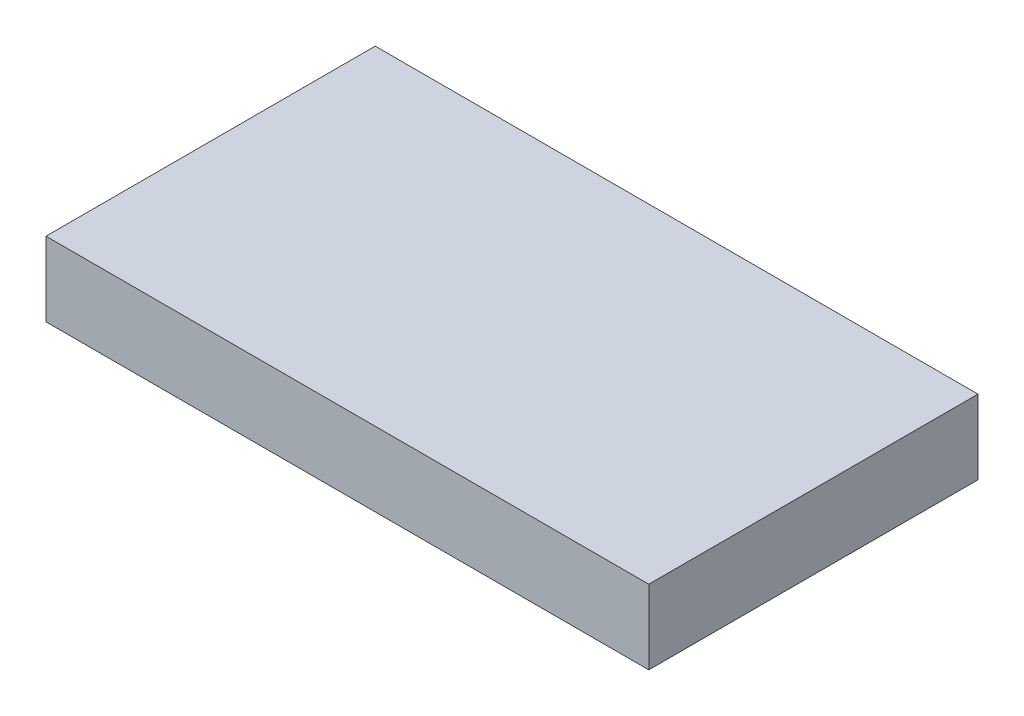
from build123d import *

# Parameters (mm, degrees)
SKETCH1_W           = 33.02
SKETCH1_H           = 18.034
BOSS_EXTRUDE1_DEPTH = 4.064


with BuildPart() as part:
    # Sketch1 → Boss-Extrude1 (new body)
    with BuildSketch(Plane(origin=(0, 0, 0), x_dir=(1, 0, 0), z_dir=(0, 1, 0))):
        Rectangle(SKETCH1_W, SKETCH1_H)
    extrude(amount=BOSS_EXTRUDE1_DEPTH)


solid = part.part
